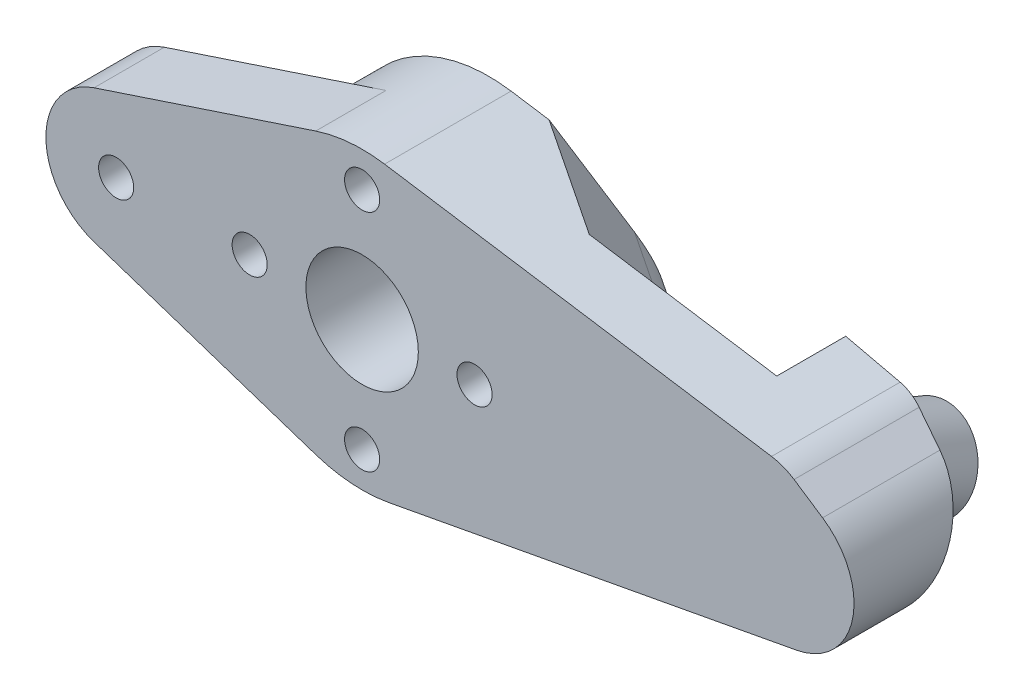
from build123d import *
from OCP.BRepFilletAPI import BRepFilletAPI_MakeChamfer

# Parameters (mm, degrees)
BOSS_EXTRU_1_DEPTH                  = 10
ENL_V_MAT_EXTRU_1_REACH             = 39.885
ESQUISSE2_R                         = 4
ESQUISSE2_R_2                       = 1.25
ENL_V_MAT_EXTRU_2_REACH             = 39.885
ENL_V_MAT_EXTRU_2_DIRECTION_2_REACH = 39.885
BOSS_EXTRU_2_START                  = 2
BOSS_EXTRU_2_DEPTH                  = 2
ENL_V_MAT_EXTRU_3_REACH             = 40.347
ESQUISSE7_R                         = 1.25
ENL_V_MAT_EXTRU_4_DEPTH             = 6
ESQUISSE8_W                         = 13.848155074
ESQUISSE8_H                         = 21.741024256
ENL_V_MAT_EXTRU_5_DEPTH             = 2.4
BOSS_EXTRU_3_START                  = 3
ESQUISSE9_R                         = 3.222512383
ESQUISSE9_R_2                       = 1.25
BOSS_EXTRU_3_DEPTH                  = 3
CHANFREIN1_SIZE                     = 4
CHANFREIN1_SIZE2                    = 4.360122539
CHANFREIN1_SIZE2_2                  = 4.445329843
CONG_1_R                            = 4
ESQUISSE10_R                        = 15.601739672
ENL_V_MAT_EXTRU_6_DEPTH             = 1
BOSS_EXTRU_5_START                  = -5
ESQUISSE13_R                        = 1.25
BOSS_EXTRU_5_DEPTH                  = 5
ENL_V_MAT_EXTRU_7_DEPTH             = 1.5


with BuildPart() as part:
    # Esquisse1 → Boss.-Extru.1 (new body)
    with BuildSketch(Plane.XY):
        with BuildLine():
            Line((30.916666667, -4.915254034), (1.925, -10.322033472))
            ThreePointArc((1.925, -10.322033472), (-10.498702111, -0.165087796), (1.599509013, 10.377454934))
            Line((1.599509013, 10.377454934), (30, 6))
            Line((30, 6), (32.763853992, 4.166666667))
            ThreePointArc((32.763853992, 4.166666667), (34.899681519, -0.996554572), (30.916666667, -4.915254034))
        make_face()
    extrude(amount=BOSS_EXTRU_1_DEPTH)

    # Esquisse2 → Enlèv. mat.-Extru.1 (cut, up to next)
    with BuildSketch(Plane.XY.offset(10), mode=Mode.PRIVATE) as enl_v_mat_extru_1_sk1:
        Circle(ESQUISSE2_R)
    enl_v_mat_extru_1_tool1 = extrude(enl_v_mat_extru_1_sk1.sketch, amount=-ENL_V_MAT_EXTRU_1_REACH, mode=Mode.PRIVATE) & part.part
    # Esquisse2 → Enlèv. mat.-Extru.1 (cut, up to next)
    with BuildSketch(Plane.XY.offset(10), mode=Mode.PRIVATE) as enl_v_mat_extru_1_sk2:
        with Locations((0, 8)):
            Circle(ESQUISSE2_R_2)
    enl_v_mat_extru_1_tool2 = extrude(enl_v_mat_extru_1_sk2.sketch, amount=-ENL_V_MAT_EXTRU_1_REACH, mode=Mode.PRIVATE) & part.part
    # Esquisse2 → Enlèv. mat.-Extru.1 (cut, up to next)
    with BuildSketch(Plane.XY.offset(10), mode=Mode.PRIVATE) as enl_v_mat_extru_1_sk3:
        with Locations((8, 0)):
            Circle(ESQUISSE2_R_2)
    enl_v_mat_extru_1_tool3 = extrude(enl_v_mat_extru_1_sk3.sketch, amount=-ENL_V_MAT_EXTRU_1_REACH, mode=Mode.PRIVATE) & part.part
    # Esquisse2 → Enlèv. mat.-Extru.1 (cut, up to next)
    with BuildSketch(Plane.XY.offset(10), mode=Mode.PRIVATE) as enl_v_mat_extru_1_sk4:
        with Locations((0, -8)):
            Circle(ESQUISSE2_R_2)
    enl_v_mat_extru_1_tool4 = extrude(enl_v_mat_extru_1_sk4.sketch, amount=-ENL_V_MAT_EXTRU_1_REACH, mode=Mode.PRIVATE) & part.part
    # Esquisse2 → Enlèv. mat.-Extru.1 (cut, up to next)
    with BuildSketch(Plane.XY.offset(10), mode=Mode.PRIVATE) as enl_v_mat_extru_1_sk5:
        with Locations((-8, 0)):
            Circle(ESQUISSE2_R_2)
    enl_v_mat_extru_1_tool5 = extrude(enl_v_mat_extru_1_sk5.sketch, amount=-ENL_V_MAT_EXTRU_1_REACH, mode=Mode.PRIVATE) & part.part
    add(enl_v_mat_extru_1_tool1.solids().sort_by_distance((0, 0, 10))[0], mode=Mode.SUBTRACT)
    add(enl_v_mat_extru_1_tool2.solids().sort_by_distance((0, 8, 10))[0], mode=Mode.SUBTRACT)
    add(enl_v_mat_extru_1_tool3.solids().sort_by_distance((8, 0, 10))[0], mode=Mode.SUBTRACT)
    add(enl_v_mat_extru_1_tool4.solids().sort_by_distance((0, -8, 10))[0], mode=Mode.SUBTRACT)
    add(enl_v_mat_extru_1_tool5.solids().sort_by_distance((-8, 0, 10))[0], mode=Mode.SUBTRACT)

    # Enlèv. mat.-Extru.2: up to this plane
    enl_v_mat_extru_2_end = Plane(origin=(30.916666667, -4.915254034, 10), z_dir=(-0.18333333333333338, 0.9830508068705753, 0))
    # Esquisse4 → Enlèv. mat.-Extru.2 (cut, up to the surface)
    with BuildSketch(Plane(origin=(0, 0, 0), x_dir=(1, 0, 0), z_dir=(0, 1, 0)), mode=Mode.PRIVATE) as enl_v_mat_extru_2_sk1:
        Polygon((20, -5.5), (25, -5.5), (25, 0), (11, 0), align=None)
    enl_v_mat_extru_2_tool1 = split(extrude(enl_v_mat_extru_2_sk1.sketch, amount=-ENL_V_MAT_EXTRU_2_REACH, mode=Mode.PRIVATE), bisect_by=enl_v_mat_extru_2_end, keep=Keep.BOTH, mode=Mode.PRIVATE)
    add(enl_v_mat_extru_2_tool1.solids().sort_by_distance((19.894737, 0, 2.315789))[0], mode=Mode.SUBTRACT)

    # Enlèv. mat.-Extru.2 direction 2: up to this plane
    enl_v_mat_extru_2_direction_2_end = Plane(origin=(1.599509013, 10.377454934, 10), z_dir=(-0.15233419172434606, -0.98832904137827, 0))
    # Esquisse4 → Enlèv. mat.-Extru.2 direction 2 (cut, up to the surface)
    with BuildSketch(Plane(origin=(0, 0, 0), x_dir=(1, 0, 0), z_dir=(0, 1, 0)), mode=Mode.PRIVATE) as enl_v_mat_extru_2_direction_2_sk1:
        Polygon((20, -5.5), (25, -5.5), (25, 0), (11, 0), align=None)
    enl_v_mat_extru_2_direction_2_tool1 = split(extrude(enl_v_mat_extru_2_direction_2_sk1.sketch, amount=ENL_V_MAT_EXTRU_2_DIRECTION_2_REACH, mode=Mode.PRIVATE), bisect_by=enl_v_mat_extru_2_direction_2_end, keep=Keep.BOTH, mode=Mode.PRIVATE)
    add(enl_v_mat_extru_2_direction_2_tool1.solids().sort_by_distance((19.894737, 0, 2.315789))[0], mode=Mode.SUBTRACT)

    # Esquisse5 → Boss.-Extru.2 (add)
    with BuildSketch(Plane(origin=(0, 0, 0), x_dir=(-1, 0, 0), z_dir=(0, 0, -1)).offset(BOSS_EXTRU_2_START)):
        with BuildLine():
            Line((-25, -6.018678409), (-25, 6.770665362))
            Line((-25, 6.770665362), (-30, 6))
            Line((-30, 6), (-32.763853992, 4.166666667))
            ThreePointArc((-32.763853992, 4.166666667), (-34.899681519, -0.996554572), (-30.916666667, -4.915254034))
            Line((-30.916666667, -4.915254034), (-25, -6.018678409))
        make_face()
    extrude(amount=-BOSS_EXTRU_2_DEPTH)

    # Esquisse6 → Enlèv. mat.-Extru.3 (cut, up to next)
    with BuildSketch(Plane.ZY.offset(-25), mode=Mode.PRIVATE) as enl_v_mat_extru_3_sk1:
        Polygon((-2, 6.770665362), (3.214027448, -6.018678409), (-2, -6.018678409), align=None)
    enl_v_mat_extru_3_tool1 = extrude(enl_v_mat_extru_3_sk1.sketch, amount=-ENL_V_MAT_EXTRU_3_REACH, mode=Mode.PRIVATE) & part.part
    add(enl_v_mat_extru_3_tool1.solids().sort_by_distance((25, -1.755564, -0.261991))[0], mode=Mode.SUBTRACT)

    # Esquisse7 → Enlèv. mat.-Extru.4 (cut)
    with BuildSketch(Plane(origin=(0, 0.265787595, 0.651943042), x_dir=(-1, 0, 0), z_dir=(0, -0.3775175740026018, -0.9260024197156237))):
        with Locations(Location((-30, 1.25, 0), (0, 0, 90))):
            Circle(ESQUISSE7_R)
    extrude(amount=-ENL_V_MAT_EXTRU_4_DEPTH, mode=Mode.SUBTRACT)

    # Esquisse8 → Enlèv. mat.-Extru.5 (cut)
    with BuildSketch(Plane(origin=(0, 0.265787595, 0.651943042), x_dir=(-1, 0, 0), z_dir=(0, -0.3775175740026018, -0.9260024197156237))):
        with Locations((-31.924077537, 0.043327094)):
            Rectangle(ESQUISSE8_W, ESQUISSE8_H)
    extrude(amount=-ENL_V_MAT_EXTRU_5_DEPTH, mode=Mode.SUBTRACT)

    # Esquisse9 → Boss.-Extru.3 (add)
    with BuildSketch(Plane(origin=(0, 1.171829772, 2.87434885), x_dir=(-1, 0, 0), z_dir=(0, -0.37751757400260183, -0.9260024197156237)).offset(BOSS_EXTRU_3_START)):
        with Locations(Location((-30, 1.25, 0), (0, 0, 125.615228438))):
            Circle(ESQUISSE9_R)
        with Locations(Location((-30, 1.25, 0), (0, 0, 90))):
            Circle(ESQUISSE9_R_2, mode=Mode.SUBTRACT)
    extrude(amount=-BOSS_EXTRU_3_DEPTH)

    # Chanfrein1: one chamfer whose edges measure the first distance from different faces: ONE call of the kernel's chamfer builder (chamfer() names one face for all edges)
    chanfrein1_edges_1 = [part.edges().sort_by_distance(p)[0] for p in [
        (15.5, 8.23492955, 2.75),
    ]]
    chanfrein1_side_1 = [part.faces().sort_by_distance(p)[0] for p in [
        (15.356524745, 0.219956318, 2.662320677),
    ]]
    chanfrein1_edges_2 = [part.edges().sort_by_distance(p)[0] for p in [
        (15.5, -7.790373885, 2.75),
    ]]
    chanfrein1_side_2 = [part.faces().sort_by_distance(p)[0] for p in [
        (13.6786873, -8.13003825, 6.041602489),
    ]]
    chanfrein1 = BRepFilletAPI_MakeChamfer(part.part.solid().wrapped)
    for e in chanfrein1_edges_1:
        chanfrein1.Add(CHANFREIN1_SIZE, CHANFREIN1_SIZE2, e.wrapped, chanfrein1_side_1[0].wrapped)  # the first distance lies on this face
    for e in chanfrein1_edges_2:
        chanfrein1.Add(CHANFREIN1_SIZE, CHANFREIN1_SIZE2_2, e.wrapped, chanfrein1_side_2[0].wrapped)  # the first distance lies on this face
    add(Compound.cast(chanfrein1.Shape()), mode=Mode.REPLACE)

    # Congé1
    cong_1_edges = [part.edges().sort_by_distance(p)[0] for p in [
        (15.5, -3.289111279, 2.75),
        (15.5, 4.200483399, 2.75),
        (30, 6, 5.452987412),
    ]]
    fillet(cong_1_edges, radius=CONG_1_R)

    # Esquisse10 → Enlèv. mat.-Extru.6 (cut)
    with BuildSketch(Plane(origin=(0, 0, 0), x_dir=(-1, 0, 0), z_dir=(0, 0, -1))):
        Circle(ESQUISSE10_R)
    extrude(amount=-ENL_V_MAT_EXTRU_6_DEPTH, mode=Mode.SUBTRACT)

    # Esquisse13 → Boss.-Extru.5 (add)
    with BuildSketch(Plane.XY.offset(10).offset(BOSS_EXTRU_5_START)):
        with BuildLine():
            Line((-3.3, -9.967948636), (-19.071428571, -4.746642207))
            ThreePointArc((-19.071428571, -4.746642207), (-22.5, 0), (-19.071428571, 4.746642207))
            Line((-19.071428571, 4.746642207), (-3.3, 9.967948636))
            ThreePointArc((-3.3, 9.967948636), (-10.5, 0), (-3.3, -9.967948636))
        make_face()
        with Locations((-17.5, 0)):
            Circle(ESQUISSE13_R, mode=Mode.SUBTRACT)
    extrude(amount=BOSS_EXTRU_5_DEPTH)

    # Esquisse14 → Enlèv. mat.-Extru.7 (cut)
    with BuildSketch(Plane(origin=(-3.3, -9.967948636, 0), x_dir=(0.9493284414763515, -0.3142857142857143, 0), z_dir=(-0.3142857142857143, -0.9493284414763515, 0))):
        Polygon((-14.932458463, 9.25), (-14.280415194, 9.25), (-13.481837469, 6.80869391), (-12.677650771, 9.25), (-12.031917598, 9.25), (-11.440170803, 5.75), (-12.076088271, 5.75), (-12.449786187, 7.960637019), (-13.17755061, 5.75), (-13.790331059, 5.75), (-14.513888751, 7.960637019), (-14.886885546, 5.75), (-15.523504136, 5.75), align=None)
        with BuildLine():
            Line((-10.318375931, 8.397435897), (-10.946581059, 8.397435897))
            add(Edge.make_bspline(
                [(-10.946581059, 8.397435897), (-10.942145692, 8.428837631), (-10.933450449, 8.490398649), (-10.912643894, 8.579523667), (-10.887757009, 8.664064846), (-10.856687005, 8.743754462), (-10.820246945, 8.818734468), (-10.778807384, 8.889262159), (-10.731920344, 8.955034816), (-10.695980932, 8.994656526), (-10.678051412, 9.014423077)],
                knots=[0, 0, 0, 0, 1.111473889, 2.178970933, 3.205615836, 4.199322666, 5.174200091, 6.12565194, 7.064921805, 8, 8, 8, 8], degree=3))
            add(Edge.make_bspline(
                [(-10.678051412, 9.014423077), (-10.652190455, 9.040503609), (-10.601221227, 9.091905597), (-10.516045669, 9.157745865), (-10.426765954, 9.21472614), (-10.331591538, 9.259900514), (-10.232003408, 9.296463936), (-10.127209603, 9.321023669), (-10.01763835, 9.337319269), (-9.942869754, 9.338924443), (-9.904714072, 9.33974359)],
                knots=[0, 0, 0, 0, 1.01925491, 2.00884431, 2.983262333, 3.955970413, 4.92937149, 5.924503185, 6.940838805, 8, 8, 8, 8], degree=3))
            add(Edge.make_bspline(
                [(-9.904714072, 9.33974359), (-9.870791708, 9.338942749), (-9.804107175, 9.337368458), (-9.706097692, 9.324730903), (-9.612653851, 9.302566039), (-9.522787925, 9.273585976), (-9.437821548, 9.234153758), (-9.35587943, 9.188381345), (-9.279251037, 9.132239579), (-9.207757073, 9.068805033), (-9.142076231, 9.000194362), (-9.085196334, 8.926855197), (-9.036295666, 8.850746596), (-8.996007984, 8.771236241), (-8.965032231, 8.68818959), (-8.94353414, 8.602086394), (-8.929463117, 8.513116644), (-8.928061276, 8.452645104), (-8.92735029, 8.42197516)],
                knots=[0, 0, 0, 0, 1.091422571, 2.145516843, 3.172569842, 4.178562979, 5.178154469, 6.181868002, 7.194278174, 8.227918432, 9.254613415, 10.245994977, 11.209837596, 12.161663635, 13.10878368, 14.055455738, 15.013766427, 16, 16, 16, 16], degree=3))
            add(Edge.make_bspline(
                [(-8.92735029, 8.42197516), (-8.928809275, 8.383992989), (-8.931681568, 8.309217771), (-8.955250814, 8.199778683), (-8.992143092, 8.095135386), (-9.045437576, 7.996751995), (-9.112069255, 7.904896255), (-9.193824093, 7.822639179), (-9.288373501, 7.748691089), (-9.359353001, 7.708951376), (-9.395699649, 7.688601763)],
                knots=[0, 0, 0, 0, 0.992805628, 1.954529043, 2.915727527, 3.886831945, 4.871318353, 5.87440735, 6.911542536, 8, 8, 8, 8], degree=3))
            add(Edge.make_bspline(
                [(-9.395699649, 7.688601763), (-9.370751868, 7.680410881), (-9.321730597, 7.664316166), (-9.252052754, 7.632617805), (-9.185797087, 7.597976752), (-9.124104496, 7.55773298), (-9.066361372, 7.513513768), (-9.012919725, 7.464941116), (-8.963460252, 7.412120934), (-8.918790361, 7.35476273), (-8.879144087, 7.293783839), (-8.843571596, 7.230592836), (-8.814293453, 7.164231418), (-8.789491222, 7.095457477), (-8.770608214, 7.02365291), (-8.75731289, 6.949095953), (-8.749627866, 6.871956675), (-8.748455769, 6.819694861), (-8.74786311, 6.793269231)],
                knots=[0, 0, 0, 0, 1.059543567, 2.081955587, 3.086750234, 4.076226789, 5.052108497, 6.020845489, 6.989030705, 7.970690546, 8.952259656, 9.923888338, 10.895517021, 11.877585046, 12.873342345, 13.889638361, 14.932918083, 16, 16, 16, 16], degree=3))
            add(Edge.make_bspline(
                [(-8.74786311, 6.793269231), (-8.749064509, 6.754434283), (-8.751433422, 6.677859676), (-8.766493861, 6.565073116), (-8.794533687, 6.457541152), (-8.83142163, 6.354026466), (-8.880626143, 6.255865394), (-8.938531582, 6.160805276), (-9.009709001, 6.072142768), (-9.088810482, 5.987533864), (-9.176657287, 5.910611238), (-9.271897515, 5.843922782), (-9.372436915, 5.786692221), (-9.478911571, 5.740230822), (-9.591284492, 5.70445023), (-9.709305208, 5.678586369), (-9.833469609, 5.662762431), (-9.918221528, 5.661103592), (-9.961504937, 5.66025641)],
                knots=[0, 0, 0, 0, 1.005138573, 1.981928558, 2.936866704, 3.876260664, 4.820238198, 5.773547, 6.751179199, 7.756627054, 8.768222608, 9.766606018, 10.760583154, 11.757261445, 12.767156078, 13.807575856, 14.880313354, 16, 16, 16, 16], degree=3))
            add(Edge.make_bspline(
                [(-9.961504937, 5.66025641), (-10.002450344, 5.66114962), (-10.08251367, 5.662896173), (-10.19962304, 5.678013474), (-10.310924411, 5.702398908), (-10.416701825, 5.736772198), (-10.51654604, 5.781348482), (-10.61136248, 5.834428835), (-10.699259105, 5.899074806), (-10.781215256, 5.972368157), (-10.855412898, 6.054599134), (-10.921728117, 6.143862899), (-10.978698651, 6.240498884), (-11.026558136, 6.344094222), (-11.06493242, 6.454830648), (-11.095201942, 6.572482976), (-11.116345699, 6.69728106), (-11.122785074, 6.783144797), (-11.126068239, 6.826923077)],
                knots=[0, 0, 0, 0, 1.066544725, 2.085487077, 3.070979577, 4.031932826, 4.977951092, 5.916076795, 6.857635327, 7.814973522, 8.776389752, 9.738577119, 10.707772778, 11.69409279, 12.707140348, 13.757286496, 14.856535458, 16, 16, 16, 16], degree=3))
            Line((-11.126068239, 6.826923077), (-10.49786311, 6.826923077))
            add(Edge.make_bspline(
                [(-10.49786311, 6.826923077), (-10.49388224, 6.804910783), (-10.486128451, 6.762036069), (-10.471005161, 6.699963013), (-10.451297404, 6.642665749), (-10.428510334, 6.58963502), (-10.403896868, 6.540174551), (-10.374157914, 6.496111038), (-10.341472588, 6.456247979), (-10.294307425, 6.408858334), (-10.226881575, 6.360167452), (-10.13583434, 6.317852759), (-10.034552912, 6.293051151), (-9.963747094, 6.29002543), (-9.927149969, 6.288461538)],
                knots=[0, 0, 0, 0, 0.928156231, 1.807827665, 2.648129825, 3.438902246, 4.202261636, 4.936546065, 5.639352463, 6.338805438, 7.70633318, 9.064371875, 10.482673459, 12, 12, 12, 12], degree=3))
            add(Edge.make_bspline(
                [(-9.927149969, 6.288461538), (-9.907730242, 6.288794555), (-9.869691339, 6.289446859), (-9.813817856, 6.296676775), (-9.760590496, 6.308584452), (-9.709910121, 6.324766545), (-9.661454096, 6.34505181), (-9.616148222, 6.371208445), (-9.573069053, 6.401619267), (-9.532684897, 6.435809104), (-9.495369105, 6.473063787), (-9.464320172, 6.51431702), (-9.435943693, 6.556237678), (-9.414956245, 6.601568358), (-9.396566719, 6.647869785), (-9.38531139, 6.696822556), (-9.376812808, 6.747399774), (-9.376318905, 6.782012602), (-9.376068239, 6.799579327)],
                knots=[0, 0, 0, 0, 1.110435564, 2.175094844, 3.216326037, 4.226890168, 5.215276772, 6.21526065, 7.213097102, 8.228249917, 9.239874822, 10.221364777, 11.178138315, 12.128914389, 13.072518965, 14.022636769, 14.996447288, 16, 16, 16, 16], degree=3))
            add(Edge.make_bspline(
                [(-9.376068239, 6.799579327), (-9.376733711, 6.818791534), (-9.378058513, 6.857038636), (-9.388882284, 6.91285224), (-9.405975307, 6.966540428), (-9.429719604, 7.017865444), (-9.461427466, 7.066638115), (-9.498842389, 7.113836968), (-9.544912052, 7.157005386), (-9.595456641, 7.199676059), (-9.654068508, 7.236872017), (-9.717893173, 7.271198421), (-9.788608046, 7.298511641), (-9.864486916, 7.322907405), (-9.9469651, 7.340725692), (-10.035530442, 7.353663506), (-10.13004007, 7.363293703), (-10.195186786, 7.364675313), (-10.228632341, 7.365384615)],
                knots=[0, 0, 0, 0, 0.809814727, 1.612155564, 2.388397, 3.182215007, 3.988903953, 4.837162975, 5.715530372, 6.646997145, 7.623086902, 8.637258368, 9.698941581, 10.815059213, 11.996518529, 13.252603015, 14.589518788, 16, 16, 16, 16], degree=3))
            Line((-10.228632341, 7.365384615), (-10.228632341, 7.948717949))
            add(Edge.make_bspline(
                [(-10.228632341, 7.948717949), (-10.186990636, 7.95226429), (-10.109087251, 7.958898791), (-10.000953176, 7.974413803), (-9.909918224, 7.995152172), (-9.833794369, 8.020171891), (-9.770585997, 8.052303729), (-9.715367512, 8.087775858), (-9.66781074, 8.128971553), (-9.627618889, 8.174662363), (-9.595466659, 8.223730008), (-9.572711183, 8.275411832), (-9.557684656, 8.328108735), (-9.556260894, 8.364151828), (-9.555555418, 8.382011218)],
                knots=[0, 0, 0, 0, 1.70044513, 3.18119609, 4.440695891, 5.496282586, 6.431922213, 7.318171381, 8.16090191, 8.983045123, 9.787564368, 10.536848927, 11.275007137, 12, 12, 12, 12], degree=3))
            add(Edge.make_bspline(
                [(-9.555555418, 8.382011218), (-9.556772566, 8.40479786), (-9.55914818, 8.449272562), (-9.577598487, 8.512925229), (-9.60962613, 8.569666306), (-9.652569575, 8.619376394), (-9.704897656, 8.660897985), (-9.76623534, 8.691041952), (-9.835251597, 8.708752878), (-9.883808251, 8.710588905), (-9.908920803, 8.711538462)],
                knots=[0, 0, 0, 0, 1.009664648, 1.970651636, 2.907870547, 3.878035693, 4.867062054, 5.849714035, 6.887914197, 8, 8, 8, 8], degree=3))
            add(Edge.make_bspline(
                [(-9.908920803, 8.711538462), (-9.931682507, 8.710418084), (-9.9768487, 8.708194913), (-10.042895192, 8.691601749), (-10.105617356, 8.663669222), (-10.163716392, 8.625151914), (-10.216353628, 8.57889426), (-10.259553612, 8.52411167), (-10.295485311, 8.464086265), (-10.310715812, 8.419739782), (-10.318375931, 8.397435897)],
                knots=[0, 0, 0, 0, 0.98818071, 1.960853194, 2.938124878, 3.957524365, 4.978590984, 5.968022688, 6.978025184, 8, 8, 8, 8], degree=3))
        make_face()
    extrude(amount=-ENL_V_MAT_EXTRU_7_DEPTH, mode=Mode.SUBTRACT)


solid = part.part
